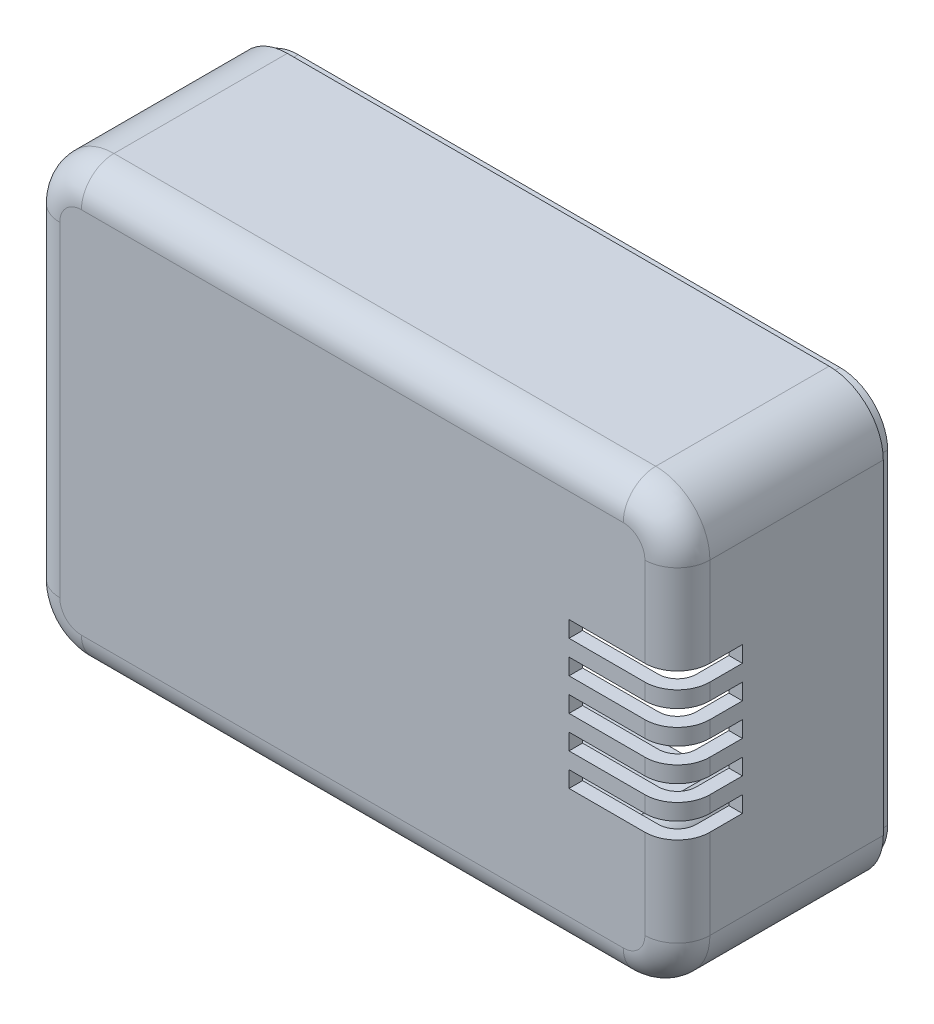
from build123d import *

# Parameters (mm, degrees)
EXTRUDE_1_DEPTH        = 40
FILLET_1_R             = 6
SHELL_1_T              = -2.5
CUT_EXTRUDE_1_DEPTH    = 2
SKETCH_5_W             = 25
SKETCH_5_H             = 17
CUT_EXTRUDE_4_DEPTH    = 1.5
PATTERN_LINEAR_1_COUNT = 5
PATTERN_LINEAR_1_PITCH = 6
SKETCH_6_R             = 4
EXTRUDE_2_DEPTH        = 32.5
SKETCH_7_R             = 1.25
CUT_EXTRUDE_5_DEPTH    = 12


with BuildPart() as part:
    # 草图1 → 凸台-拉伸1 (new body)
    with BuildSketch(Plane.XY):
        with BuildLine():
            Line((-50, -40), (50, -40))
            ThreePointArc((50, -40), (57.071067812, -37.071067812), (60, -30))
            Line((60, -30), (60, 30))
            ThreePointArc((60, 30), (57.071067812, 37.071067812), (50, 40))
            Line((50, 40), (-50, 40))
            ThreePointArc((-50, 40), (-57.071067812, 37.071067812), (-60, 30))
            Line((-60, 30), (-60, -30))
            ThreePointArc((-60, -30), (-57.071067812, -37.071067812), (-50, -40))
        make_face()
    extrude(amount=EXTRUDE_1_DEPTH)

    # 圆角1
    fillet_1_edges = [part.edges().sort_by_distance(p)[0] for p in [
        (57.071067812, -37.071067812, 40),
        (60, 0, 40),
        (57.071067812, 37.071067812, 40),
        (0, 40, 40),
        (-57.071067812, 37.071067812, 40),
        (-60, 0, 40),
        (-57.071067812, -37.071067812, 40),
        (0, -40, 40),
    ]]
    fillet(fillet_1_edges, radius=FILLET_1_R)

    # 抽壳1
    shell_1_openings = [part.faces().sort_by_distance(p)[0] for p in [
        (0, 0, 0),
    ]]
    offset(amount=SHELL_1_T, openings=shell_1_openings, kind=Kind.INTERSECTION)

    # 草图2 → 切除-拉伸1 (cut)
    with BuildSketch(Plane.XY):
        with BuildLine():
            Line((-50, -45), (50, -45))
            ThreePointArc((50, -45), (60.606601718, -40.606601718), (65, -30))
            Line((65, -30), (65, 30))
            ThreePointArc((65, 30), (60.606601718, 40.606601718), (50, 45))
            Line((50, 45), (-50, 45))
            ThreePointArc((-50, 45), (-60.606601718, 40.606601718), (-65, 30))
            Line((-65, 30), (-65, -30))
            ThreePointArc((-65, -30), (-60.606601718, -40.606601718), (-50, -45))
        make_face()
        with BuildLine():
            Line((-50, -38.8), (50, -38.8))
            ThreePointArc((50, -38.8), (56.222539674, -36.222539674), (58.8, -30))
            Line((58.8, -30), (58.8, 30))
            ThreePointArc((58.8, 30), (56.222539674, 36.222539674), (50, 38.8))
            Line((50, 38.8), (-50, 38.8))
            ThreePointArc((-50, 38.8), (-56.222539674, 36.222539674), (-58.8, 30))
            Line((-58.8, 30), (-58.8, -30))
            ThreePointArc((-58.8, -30), (-56.222539674, -36.222539674), (-50, -38.8))
        make_face(mode=Mode.SUBTRACT)
    extrude(amount=CUT_EXTRUDE_1_DEPTH, mode=Mode.SUBTRACT)

    # 草图5 → 切除-拉伸4 (cut, symmetric)
    with BuildSketch(Plane(origin=(0, -12, 0), x_dir=(1, 0, 0), z_dir=(0, 1, 0))):
        with Locations((52.5, -36.5)):
            Rectangle(SKETCH_5_W, SKETCH_5_H)
    cut_extrude_4 = extrude(amount=CUT_EXTRUDE_4_DEPTH, both=True, mode=Mode.SUBTRACT)

    # 阵列(线性)1: 切除-拉伸4 ×5
    with Locations(*[(0, i * PATTERN_LINEAR_1_PITCH, 0) for i in range(1, PATTERN_LINEAR_1_COUNT)]):
        add(cut_extrude_4, mode=Mode.SUBTRACT)

    # 草图6 → 凸台-拉伸2 (add)
    with BuildSketch(Plane.XY.offset(5)):
        with Locations((45, 25)):
            Circle(SKETCH_6_R)
        with Locations((45, -25)):
            Circle(SKETCH_6_R)
        with Locations((-45, 25)):
            Circle(SKETCH_6_R)
        with Locations((-45, -25)):
            Circle(SKETCH_6_R)
    extrude(amount=EXTRUDE_2_DEPTH)

    # 草图7 → 切除-拉伸5 (cut)
    with BuildSketch(Plane.XY.offset(5)):
        with Locations((45, 25)):
            Circle(SKETCH_7_R)
        with Locations((45, -25)):
            Circle(SKETCH_7_R)
        with Locations((-45, 25)):
            Circle(SKETCH_7_R)
        with Locations((-45, -25)):
            Circle(SKETCH_7_R)
    extrude(amount=CUT_EXTRUDE_5_DEPTH, mode=Mode.SUBTRACT)


solid = part.part
